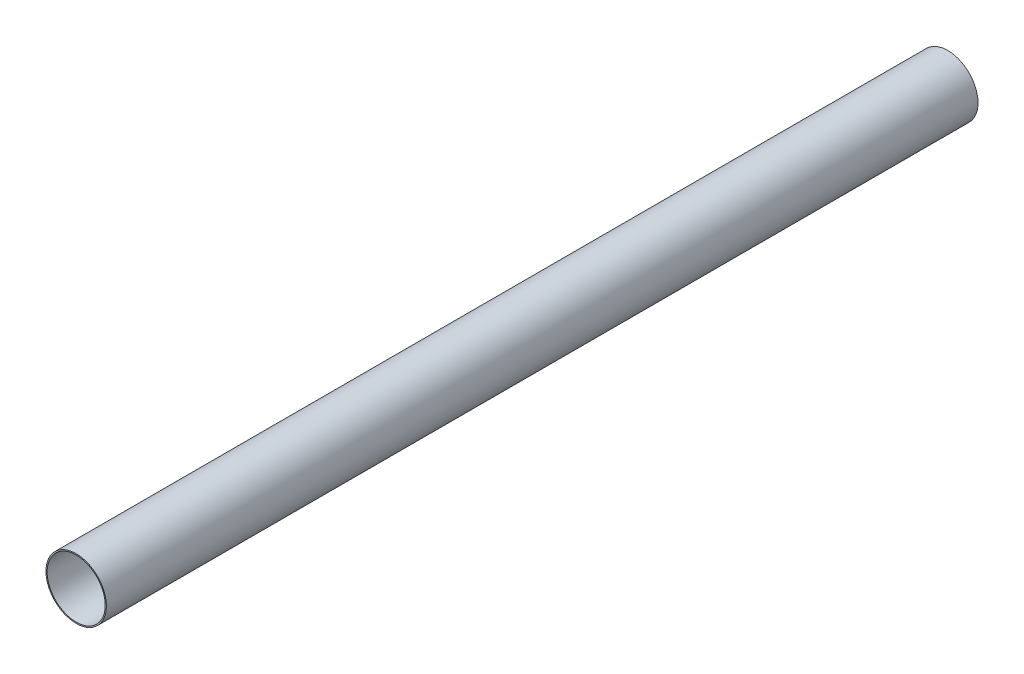
from build123d import *

# Parameters (mm, degrees)
SKETCH1_R           = 39.624
SKETCH1_R_2         = 38.1
BOSS_EXTRUDE1_DEPTH = 1143


with BuildPart() as part:
    # Sketch1 → Boss-Extrude1 (new body)
    with BuildSketch(Plane.XY):
        Circle(SKETCH1_R)
        Circle(SKETCH1_R_2, mode=Mode.SUBTRACT)
    extrude(amount=BOSS_EXTRUDE1_DEPTH)


solid = part.part
